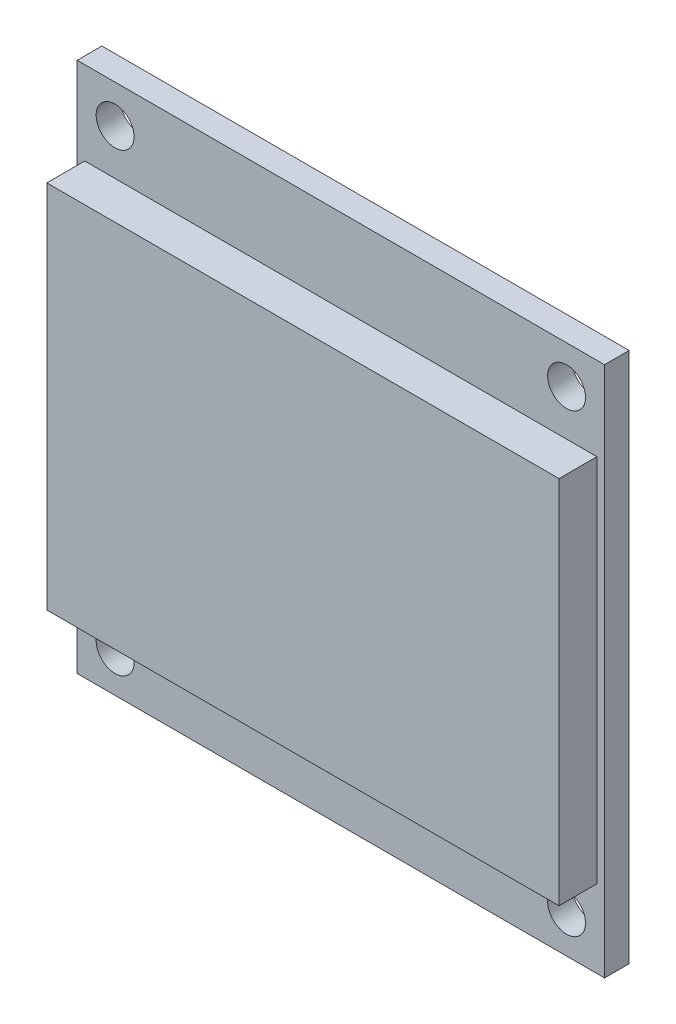
from build123d import *

# Parameters (mm, degrees)
SKETCH1_W           = 27.8
SKETCH1_H           = 28
SKETCH1_R           = 1
BOSS_EXTRUDE1_DEPTH = 1.3
SKETCH2_W           = 27
SKETCH2_H           = 19.5
BOSS_EXTRUDE2_DEPTH = 2


with BuildPart() as part:
    # Sketch1 → Boss-Extrude1 (new body)
    with BuildSketch(Plane.XY):
        with Locations((13.9, 14)):
            Rectangle(SKETCH1_W, SKETCH1_H)
        with Locations((25.8, 26)):
            Circle(SKETCH1_R, mode=Mode.SUBTRACT)
        with Locations((2, 26)):
            Circle(SKETCH1_R, mode=Mode.SUBTRACT)
        with Locations((25.8, 2)):
            Circle(SKETCH1_R, mode=Mode.SUBTRACT)
        with Locations((2, 2)):
            Circle(SKETCH1_R, mode=Mode.SUBTRACT)
    extrude(amount=BOSS_EXTRUDE1_DEPTH)

    # Sketch2 → Boss-Extrude2 (add)
    with BuildSketch(Plane.XY.offset(1.3)):
        with Locations((13.9, 13.85)):
            Rectangle(SKETCH2_W, SKETCH2_H)
    extrude(amount=BOSS_EXTRUDE2_DEPTH)


solid = part.part
